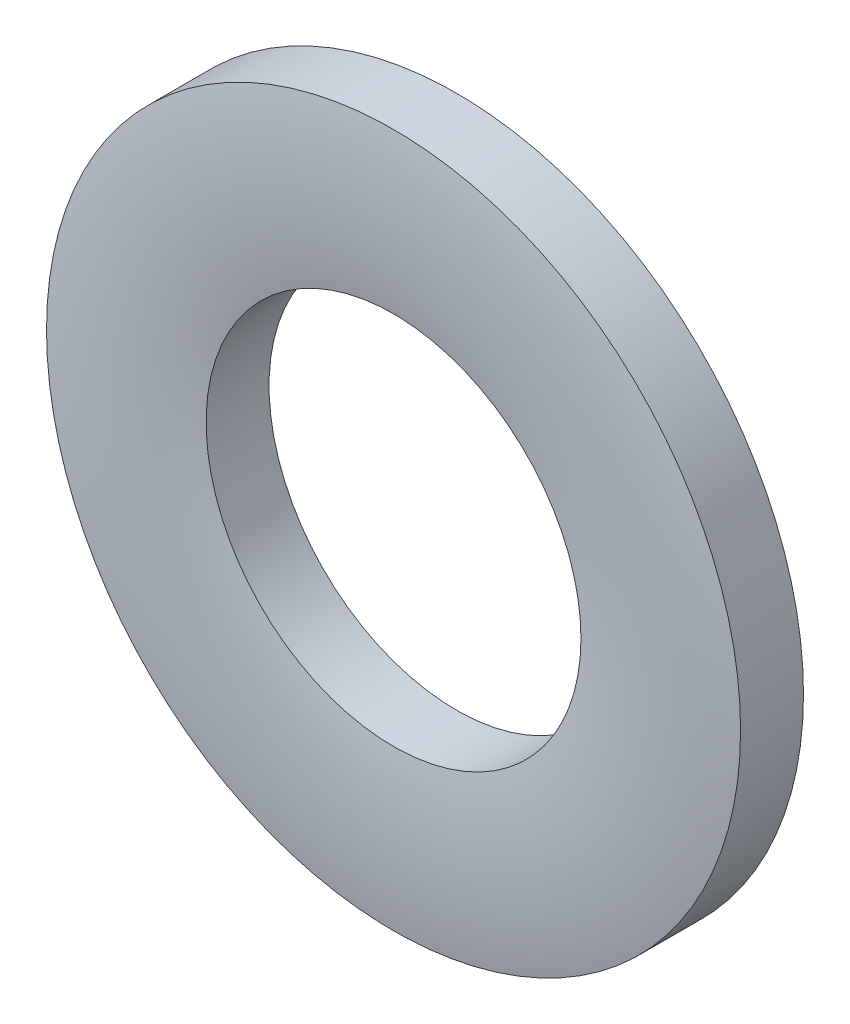
from build123d import *


with BuildPart() as part:
    # Sketch3 → Revolve1 (revolve)
    with BuildSketch(Plane(origin=(0, 0, 0), x_dir=(0, 0, -1), z_dir=(1, 0, 0)), mode=Mode.PRIVATE) as revolve1_sk:
        with BuildLine():
            Line((0.25, 2.5), (-0.20315, 2.5))
            ThreePointArc((-0.20315, 2.5), (-0.25, 1.925), (-0.20315, 1.35))
            Line((-0.20315, 1.35), (0.25, 1.35))
            Line((0.25, 1.35), (0.25, 2.5))
        make_face()
    revolve(revolve1_sk.sketch.rotate(Axis((0, 0, 0.25), (0, 0, -1)), 90), axis=Axis((0, 0, 0.25), (0, 0, -1)))


solid = part.part
